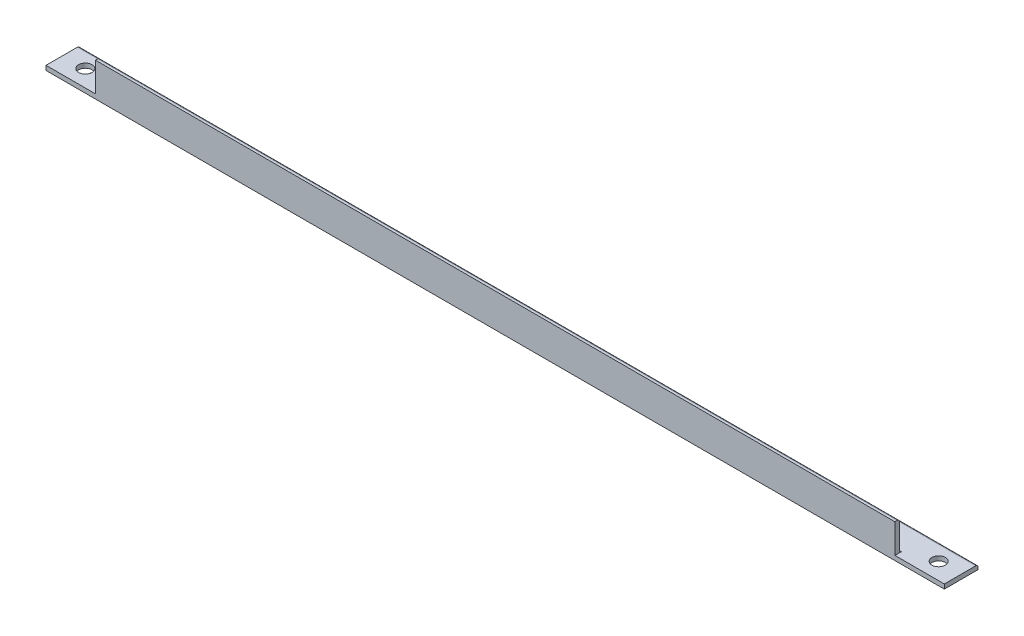
from build123d import *

# Parameters (mm, degrees)
EXTRUDE_1_DEPTH     = 400
SKETCH_2_W          = 22
SKETCH_2_H          = 13
CUT_EXTRUDE_1_DEPTH = 401.562105047
SKETCH_3_R          = 3
CUT_EXTRUDE_2_DEPTH = 401.492197177


with BuildPart() as part:
    # Эскиз1 → Бобышка-Вытянуть1 (new body)
    with BuildSketch(Plane(origin=(0, 0, 0), x_dir=(0, 0, -1), z_dir=(1, 0, 0))):
        with BuildLine():
            Line((0, 0), (0, 15))
            Line((0, 15), (1, 15))
            ThreePointArc((1, 15), (1.707106781, 14.707106781), (2, 14))
            Line((2, 14), (2, 3))
            ThreePointArc((2, 3), (2.292893219, 2.292893219), (3, 2))
            Line((3, 2), (14, 2))
            ThreePointArc((14, 2), (14.707106781, 1.707106781), (15, 1))
            Line((15, 1), (15, 0))
            Line((15, 0), (0, 0))
        make_face()
    extrude(amount=EXTRUDE_1_DEPTH)

    # Эскиз2 → Вырез-Вытянуть1 (cut, through all)
    with BuildSketch(Plane.XY):
        with Locations((389, 8.5)):
            Rectangle(SKETCH_2_W, SKETCH_2_H)
        with Locations((11, 8.5)):
            Rectangle(SKETCH_2_W, SKETCH_2_H)
    extrude(amount=-CUT_EXTRUDE_1_DEPTH, mode=Mode.SUBTRACT)

    # Эскиз3 → Вырез-Вытянуть2 (cut, through all)
    with BuildSketch(Plane(origin=(0, 2, 0), x_dir=(1, 0, 0), z_dir=(0, 1, 0))):
        with Locations(Location((390, 7.5, 0), (0, 0, 270))):
            Circle(SKETCH_3_R)
        with Locations(Location((10, 7.5, 0), (0, 0, 270))):
            Circle(SKETCH_3_R)
    extrude(amount=-CUT_EXTRUDE_2_DEPTH, mode=Mode.SUBTRACT)


solid = part.part
